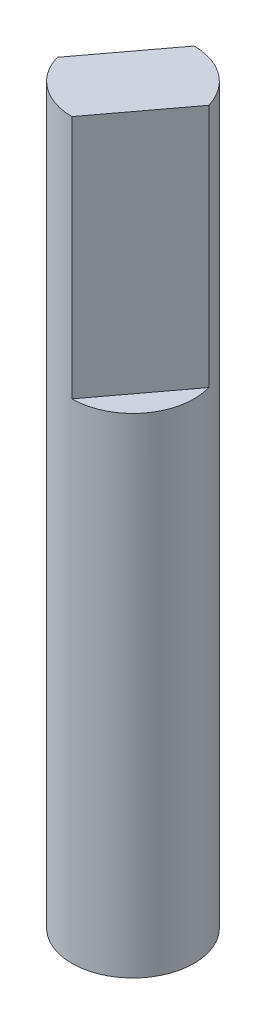
from build123d import *

# Parameters (mm, degrees)
SKETCH1_R           = 2.5
BOSS_EXTRUDE1_DEPTH = 30
CUT_EXTRUDE1_START  = -10
CUT_EXTRUDE1_DEPTH  = 10


with BuildPart() as part:
    # Sketch1 → Boss-Extrude1 (new body)
    with BuildSketch(Plane(origin=(0, 0, 0), x_dir=(1, 0, 0), z_dir=(0, 1, 0))):
        with Locations(Location((0, 0, 0), (0, 0, 270))):
            Circle(SKETCH1_R)
    extrude(amount=BOSS_EXTRUDE1_DEPTH)

    # Sketch2 → Cut-Extrude1 (cut)
    with BuildSketch(Plane(origin=(0, 30, 0), x_dir=(1, 0, 0), z_dir=(0, 1, 0)).offset(CUT_EXTRUDE1_START)):
        with BuildLine():
            Line((0, 2.5), (-2.4, -0.7))
            ThreePointArc((-2.4, -0.7), (-2, 1.5), (0, 2.5))
        make_face()
        with BuildLine():
            Line((0, -2.5), (2.4, 0.7))
            ThreePointArc((2.4, 0.7), (2, -1.5), (0, -2.5))
        make_face()
    extrude(amount=CUT_EXTRUDE1_DEPTH, mode=Mode.SUBTRACT)


solid = part.part
